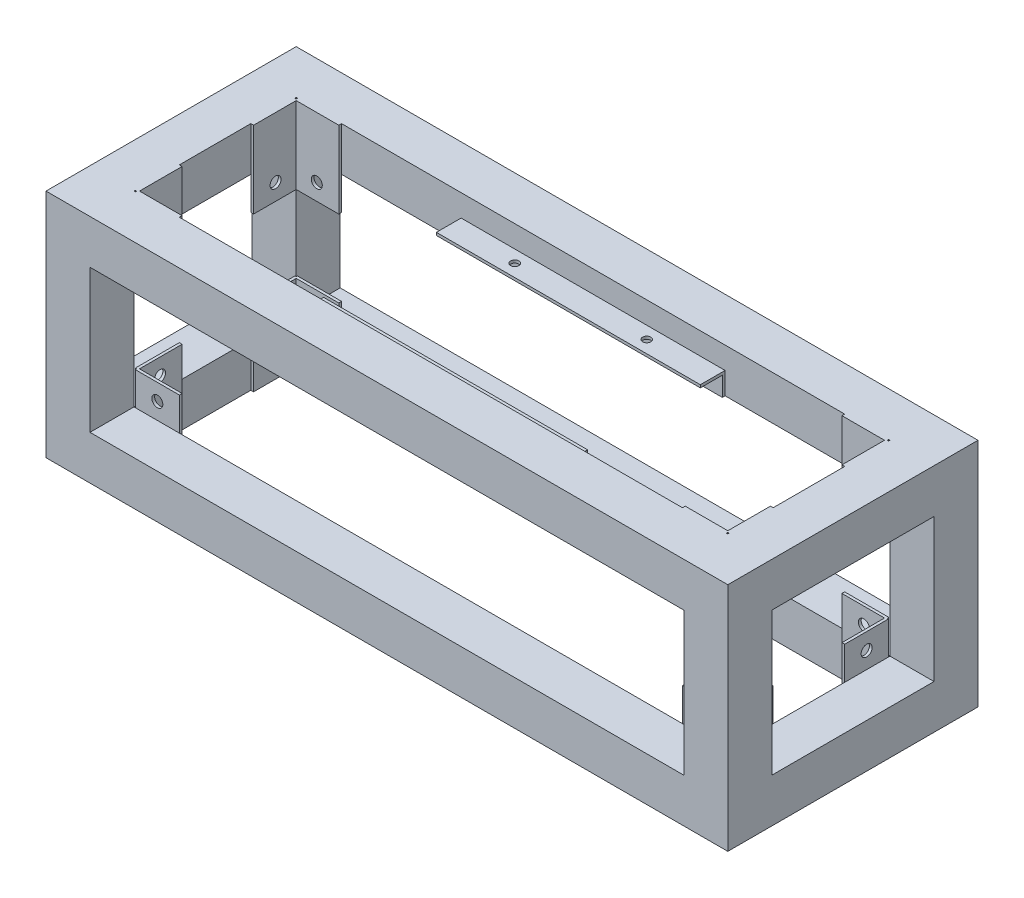
from build123d import *

# Parameters (mm, degrees)
SKETCH1_W            = 393.7
SKETCH1_H            = 144.4625
BOSS_EXTRUDE1_DEPTH  = 133.35
SKETCH6_W            = 342.9
SKETCH6_H            = 82.55
CUT_EXTRUDE4_DEPTH   = 279.211356537
SKETCH7_W            = 93.6625
SKETCH7_H            = 82.55
CUT_EXTRUDE5_DEPTH   = 422.899592292
SKETCH8_W            = 342.9
SKETCH8_H            = 93.6625
CUT_EXTRUDE6_DEPTH   = 249.494463674
SKETCH10_W           = 25.4
SKETCH10_H           = 44.45
SKETCH10_R           = 3.175
BOSS_EXTRUDE7_DEPTH  = 1.5875
SKETCH12_W           = 25.4
SKETCH12_H           = 44.45
SKETCH12_R           = 3.175
BOSS_EXTRUDE8_DEPTH  = 1.5875
SKETCH13_W           = 152.4
SKETCH13_H           = 12.7
BOSS_EXTRUDE9_DEPTH  = 1.5875
SKETCH14_W           = 152.4
SKETCH14_H           = 1.5875
BOSS_EXTRUDE10_DEPTH = 12.7
CUT_EXTRUDE8_REACH   = 243.917
SKETCH15_R           = 2.38125
CUT_EXTRUDE10_REACH  = 280.211
SKETCH17_R           = 3.175


with BuildPart() as part:
    # Sketch1 → Boss-Extrude1 (new body)
    with BuildSketch(Plane(origin=(0, 0, 0), x_dir=(1, 0, 0), z_dir=(0, 1, 0))):
        Rectangle(SKETCH1_W, SKETCH1_H)
    extrude(amount=BOSS_EXTRUDE1_DEPTH)

    # Sketch6 → Cut-Extrude4 (cut, through all)
    with BuildSketch(Plane.XY.offset(72.23125)):
        with Locations((0, 66.675)):
            Rectangle(SKETCH6_W, SKETCH6_H)
    extrude(amount=-CUT_EXTRUDE4_DEPTH, mode=Mode.SUBTRACT)

    # Sketch7 → Cut-Extrude5 (cut, through all)
    with BuildSketch(Plane.ZY.offset(196.85)):
        with Locations((0, 66.675)):
            Rectangle(SKETCH7_W, SKETCH7_H)
    extrude(amount=-CUT_EXTRUDE5_DEPTH, mode=Mode.SUBTRACT)

    # Sketch8 → Cut-Extrude6 (cut, through all)
    with BuildSketch(Plane(origin=(0, 133.35, 0), x_dir=(1, 0, 0), z_dir=(0, 1, 0))):
        Rectangle(SKETCH8_W, SKETCH8_H)
    extrude(amount=-CUT_EXTRUDE6_DEPTH, mode=Mode.SUBTRACT)

    # Sketch10 → Boss-Extrude7 (add)
    # profile 1 of 4: a face of its own
    with BuildSketch(Plane(origin=(0, 0, 46.83125), x_dir=(-1, 0, 0), z_dir=(0, 0, -1))):
        with Locations((-157.95625, 22.225)):
            Rectangle(SKETCH10_W, SKETCH10_H)
        with Locations((-157.95625, 34.925)):
            Circle(SKETCH10_R, mode=Mode.SUBTRACT)
    # profile 2 of 4: a face of its own
    with BuildSketch(Plane(origin=(0, 0, 46.83125), x_dir=(-1, 0, 0), z_dir=(0, 0, -1))):
        with Locations((157.95625, 22.225)):
            Rectangle(SKETCH10_W, SKETCH10_H)
        with Locations(Location((157.95625, 34.925, 0), (0, 0, 180))):
            Circle(SKETCH10_R, mode=Mode.SUBTRACT)
    # profile 3 of 4: a face of its own
    with BuildSketch(Plane(origin=(0, 0, 46.83125), x_dir=(-1, 0, 0), z_dir=(0, 0, -1))):
        with Locations((157.95625, 111.125)):
            Rectangle(SKETCH10_W, SKETCH10_H)
        with Locations((157.95625, 98.425)):
            Circle(SKETCH10_R, mode=Mode.SUBTRACT)
    # profile 4 of 4: a face of its own
    with BuildSketch(Plane(origin=(0, 0, 46.83125), x_dir=(-1, 0, 0), z_dir=(0, 0, -1))):
        with Locations((-157.95625, 111.125)):
            Rectangle(SKETCH10_W, SKETCH10_H)
        with Locations(Location((-157.95625, 98.425, 0), (0, 0, 180))):
            Circle(SKETCH10_R, mode=Mode.SUBTRACT)
    boss_extrude7 = extrude(amount=BOSS_EXTRUDE7_DEPTH)

    # Mirror5: Boss-Extrude7 across plane
    add(boss_extrude7.mirror(Plane.XY))

    # Sketch12 → Boss-Extrude8 (add)
    # profile 1 of 4: a face of its own
    with BuildSketch(Plane.ZY.offset(-171.45)):
        with Locations((-33.3375, 22.225)):
            Rectangle(SKETCH12_W, SKETCH12_H)
        with Locations((-33.3375, 34.925)):
            Circle(SKETCH12_R, mode=Mode.SUBTRACT)
    # profile 2 of 4: a face of its own
    with BuildSketch(Plane.ZY.offset(-171.45)):
        with Locations((33.3375, 22.225)):
            Rectangle(SKETCH12_W, SKETCH12_H)
        with Locations(Location((33.3375, 34.925, 0), (0, 0, 180))):
            Circle(SKETCH12_R, mode=Mode.SUBTRACT)
    # profile 3 of 4: a face of its own
    with BuildSketch(Plane.ZY.offset(-171.45)):
        with Locations((33.3375, 111.125)):
            Rectangle(SKETCH12_W, SKETCH12_H)
        with Locations((33.3375, 98.425)):
            Circle(SKETCH12_R, mode=Mode.SUBTRACT)
    # profile 4 of 4: a face of its own
    with BuildSketch(Plane.ZY.offset(-171.45)):
        with Locations((-33.3375, 111.125)):
            Rectangle(SKETCH12_W, SKETCH12_H)
        with Locations(Location((-33.3375, 98.425, 0), (0, 0, 180))):
            Circle(SKETCH12_R, mode=Mode.SUBTRACT)
    boss_extrude8 = extrude(amount=BOSS_EXTRUDE8_DEPTH)

    # Mirror6: Boss-Extrude8 across plane
    add(boss_extrude8.mirror(Plane(origin=(0, 0, 0), x_dir=(0, 0, 1), z_dir=(1, 0, 0))))

    # Sketch13 → Boss-Extrude9 (add)
    with BuildSketch(Plane(origin=(0, 0, 46.83125), x_dir=(-1, 0, 0), z_dir=(0, 0, -1))):
        with Locations((0, 114.3)):
            Rectangle(SKETCH13_W, SKETCH13_H)
    boss_extrude9 = extrude(amount=BOSS_EXTRUDE9_DEPTH)

    # Sketch14 → Boss-Extrude10 (add)
    with BuildSketch(Plane(origin=(0, 0, 45.24375), x_dir=(-1, 0, 0), z_dir=(0, 0, -1))):
        with Locations((0, 119.85625)):
            Rectangle(SKETCH14_W, SKETCH14_H)
    boss_extrude10 = extrude(amount=BOSS_EXTRUDE10_DEPTH)

    # Sketch15 → Cut-Extrude8 (cut, up to next)
    with BuildSketch(Plane(origin=(0, 120.65, 0), x_dir=(1, 0, 0), z_dir=(0, 1, 0)), mode=Mode.PRIVATE) as cut_extrude8_sk1:
        with Locations(Location((-38.1, -39.6875, 0), (0, 0, 180))):
            Circle(SKETCH15_R)
    cut_extrude8_tool1 = extrude(cut_extrude8_sk1.sketch, amount=-CUT_EXTRUDE8_REACH, mode=Mode.PRIVATE) & part.part
    # Sketch15 → Cut-Extrude8 (cut, up to next)
    with BuildSketch(Plane(origin=(0, 120.65, 0), x_dir=(1, 0, 0), z_dir=(0, 1, 0)), mode=Mode.PRIVATE) as cut_extrude8_sk2:
        with Locations(Location((38.1, -39.6875, 0), (0, 0, 270))):
            Circle(SKETCH15_R)
    cut_extrude8_tool2 = extrude(cut_extrude8_sk2.sketch, amount=-CUT_EXTRUDE8_REACH, mode=Mode.PRIVATE) & part.part
    cut_extrude8_1 = cut_extrude8_tool1.solids().sort_by_distance((-38.1, 120.65, 39.6875))[0]
    add(cut_extrude8_1, mode=Mode.SUBTRACT)
    cut_extrude8_2 = cut_extrude8_tool2.solids().sort_by_distance((38.1, 120.65, 39.6875))[0]
    add(cut_extrude8_2, mode=Mode.SUBTRACT)
    cut_extrude8 = cut_extrude8_1 + cut_extrude8_2  # Cut-Extrude8 as one shape, for the pattern or mirror that repeats it

    # Mirror7: Boss-Extrude9, Boss-Extrude10, Cut-Extrude8 across plane
    add(boss_extrude9.mirror(Plane.XY))
    add(boss_extrude10.mirror(Plane.XY))
    add(cut_extrude8.mirror(Plane.XY), mode=Mode.SUBTRACT)

    # Sketch17 → Cut-Extrude10 (cut, up to next)
    with BuildSketch(Plane(origin=(0, 0, -72.23125), x_dir=(-1, 0, 0), z_dir=(0, 0, -1)), mode=Mode.PRIVATE) as cut_extrude10_sk1:
        with Locations((69.85, 12.7)):
            Circle(SKETCH17_R)
    cut_extrude10_tool1 = extrude(cut_extrude10_sk1.sketch, amount=-CUT_EXTRUDE10_REACH, mode=Mode.PRIVATE) & part.part
    # Sketch17 → Cut-Extrude10 (cut, up to next)
    with BuildSketch(Plane(origin=(0, 0, -72.23125), x_dir=(-1, 0, 0), z_dir=(0, 0, -1)), mode=Mode.PRIVATE) as cut_extrude10_sk2:
        with Locations((133.35, 12.7)):
            Circle(SKETCH17_R)
    cut_extrude10_tool2 = extrude(cut_extrude10_sk2.sketch, amount=-CUT_EXTRUDE10_REACH, mode=Mode.PRIVATE) & part.part
    add(cut_extrude10_tool1.solids().sort_by_distance((-69.85, 12.7, -72.23125))[0], mode=Mode.SUBTRACT)
    add(cut_extrude10_tool2.solids().sort_by_distance((-133.35, 12.7, -72.23125))[0], mode=Mode.SUBTRACT)


solid = part.part
